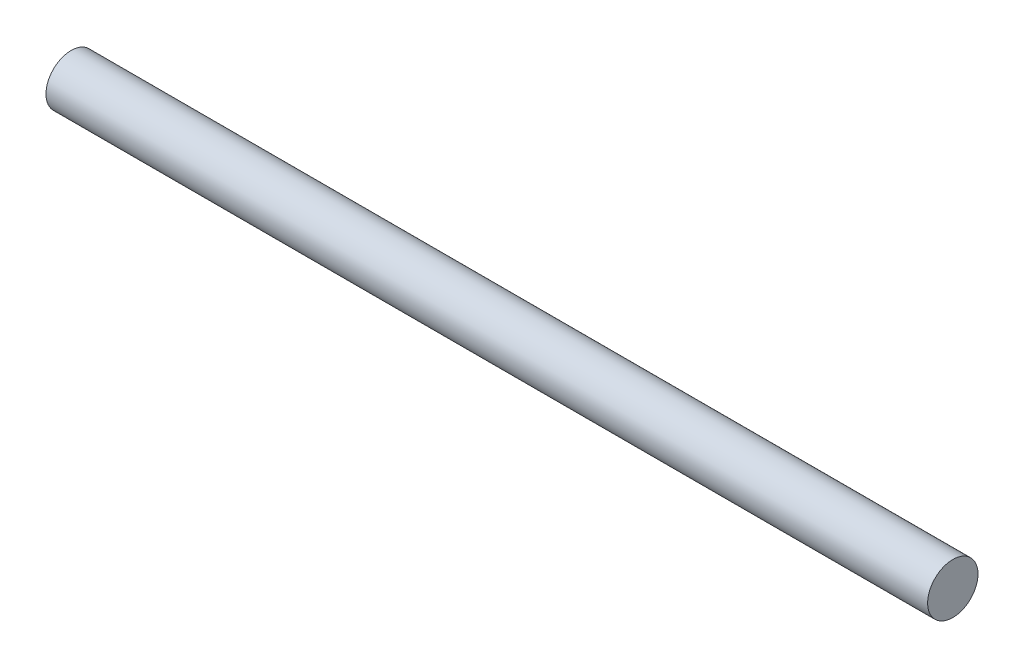
from build123d import *

# Parameters (mm, degrees)
SKETCH1_R           = 4
BOSS_EXTRUDE1_DEPTH = 70


with BuildPart() as part:
    # Sketch1 → Boss-Extrude1 (new, symmetric)
    with BuildSketch(Plane(origin=(0, 0, 0), x_dir=(0, 0, -1), z_dir=(1, 0, 0))):
        Circle(SKETCH1_R)
    extrude(amount=BOSS_EXTRUDE1_DEPTH, both=True)


solid = part.part
